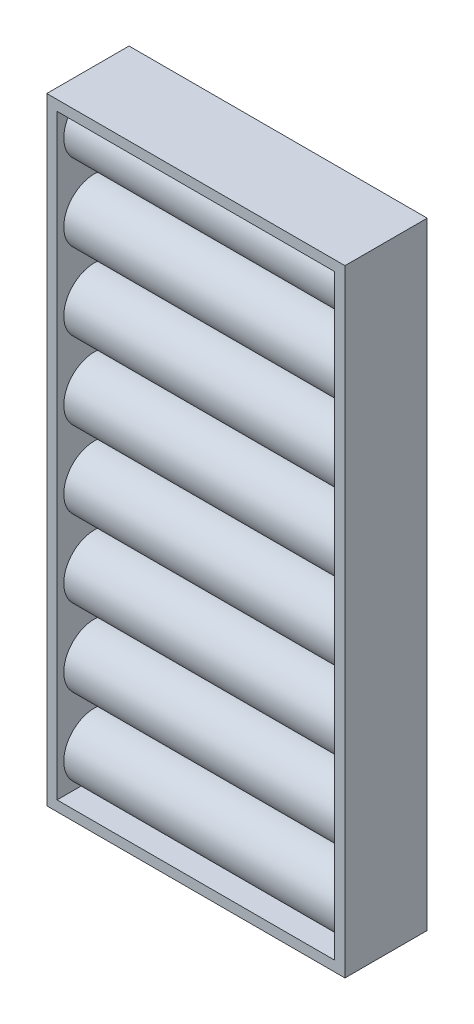
from build123d import *

# Parameters (mm, degrees)
IZIM1_W                       = 58
IZIM1_H                       = 120
Y_KSEKLIK_EKSTR_ZYON1_DEPTH   = 16
BO_ALTMA1_T                   = -2
IZIM2_R                       = 6
Y_KSEKLIK_EKSTR_ZYON2_DEPTH   = 54
Y_KSEKLIK_EKSTR_ZYON2_2_DEPTH = 54
Y_KSEKLIK_EKSTR_ZYON2_3_DEPTH = 54
Y_KSEKLIK_EKSTR_ZYON2_4_DEPTH = 54
Y_KSEKLIK_EKSTR_ZYON2_5_DEPTH = 54
Y_KSEKLIK_EKSTR_ZYON2_6_DEPTH = 54
Y_KSEKLIK_EKSTR_ZYON2_7_DEPTH = 54
Y_KSEKLIK_EKSTR_ZYON2_8_DEPTH = 54


with BuildPart() as part:
    # Çizim1 → Yükseklik-Ekstrüzyon1 (new body)
    with BuildSketch(Plane.XY):
        Rectangle(IZIM1_W, IZIM1_H)
    extrude(amount=Y_KSEKLIK_EKSTR_ZYON1_DEPTH)

    # İç Boşaltma1
    bo_altma1_openings = [part.faces().sort_by_distance(p)[0] for p in [
        (0, 0, 16),
    ]]
    offset(amount=BO_ALTMA1_T, openings=bo_altma1_openings, kind=Kind.INTERSECTION)


with BuildPart() as body_2:
    # Çizim2 → Yükseklik-Ekstrüzyon2 (new body)
    with BuildSketch(Plane(origin=(-27, 0, 0), x_dir=(0, 0, -1), z_dir=(1, 0, 0))):
        with Locations(Location((-8.693027198, -52.150296616, 0), (0, 0, 270))):
            Circle(IZIM2_R)
    extrude(amount=Y_KSEKLIK_EKSTR_ZYON2_DEPTH)


with BuildPart() as body_3:
    # Çizim2 → Y_kseklik-Ekstr_zyon2 2 (new body)
    with BuildSketch(Plane(origin=(-27, 0, 0), x_dir=(0, 0, -1), z_dir=(1, 0, 0))):
        with Locations(Location((-8.693027198, -37.150296616, 0), (0, 0, 270))):
            Circle(IZIM2_R)
    extrude(amount=Y_KSEKLIK_EKSTR_ZYON2_2_DEPTH)


with BuildPart() as body_4:
    # Çizim2 → Y_kseklik-Ekstr_zyon2 3 (new body)
    with BuildSketch(Plane(origin=(-27, 0, 0), x_dir=(0, 0, -1), z_dir=(1, 0, 0))):
        with Locations(Location((-8.693027198, -22.150296616, 0), (0, 0, 270))):
            Circle(IZIM2_R)
    extrude(amount=Y_KSEKLIK_EKSTR_ZYON2_3_DEPTH)


with BuildPart() as body_5:
    # Çizim2 → Y_kseklik-Ekstr_zyon2 4 (new body)
    with BuildSketch(Plane(origin=(-27, 0, 0), x_dir=(0, 0, -1), z_dir=(1, 0, 0))):
        with Locations(Location((-8.693027198, -7.150296616, 0), (0, 0, 270))):
            Circle(IZIM2_R)
    extrude(amount=Y_KSEKLIK_EKSTR_ZYON2_4_DEPTH)


with BuildPart() as body_6:
    # Çizim2 → Y_kseklik-Ekstr_zyon2 5 (new body)
    with BuildSketch(Plane(origin=(-27, 0, 0), x_dir=(0, 0, -1), z_dir=(1, 0, 0))):
        with Locations(Location((-8.693027198, 7.849703384, 0), (0, 0, 270))):
            Circle(IZIM2_R)
    extrude(amount=Y_KSEKLIK_EKSTR_ZYON2_5_DEPTH)


with BuildPart() as body_7:
    # Çizim2 → Y_kseklik-Ekstr_zyon2 6 (new body)
    with BuildSketch(Plane(origin=(-27, 0, 0), x_dir=(0, 0, -1), z_dir=(1, 0, 0))):
        with Locations(Location((-8.693027198, 22.849703384, 0), (0, 0, 270))):
            Circle(IZIM2_R)
    extrude(amount=Y_KSEKLIK_EKSTR_ZYON2_6_DEPTH)


with BuildPart() as body_8:
    # Çizim2 → Y_kseklik-Ekstr_zyon2 7 (new body)
    with BuildSketch(Plane(origin=(-27, 0, 0), x_dir=(0, 0, -1), z_dir=(1, 0, 0))):
        with Locations(Location((-8.693027198, 37.849703384, 0), (0, 0, 270))):
            Circle(IZIM2_R)
    extrude(amount=Y_KSEKLIK_EKSTR_ZYON2_7_DEPTH)


with BuildPart() as body_9:
    # Çizim2 → Y_kseklik-Ekstr_zyon2 8 (new body)
    with BuildSketch(Plane(origin=(-27, 0, 0), x_dir=(0, 0, -1), z_dir=(1, 0, 0))):
        with Locations(Location((-8.693027198, 52.849703384, 0), (0, 0, 270))):
            Circle(IZIM2_R)
    extrude(amount=Y_KSEKLIK_EKSTR_ZYON2_8_DEPTH)


solid = Compound([part.part, body_2.part, body_3.part, body_4.part, body_5.part, body_6.part, body_7.part, body_8.part, body_9.part])
